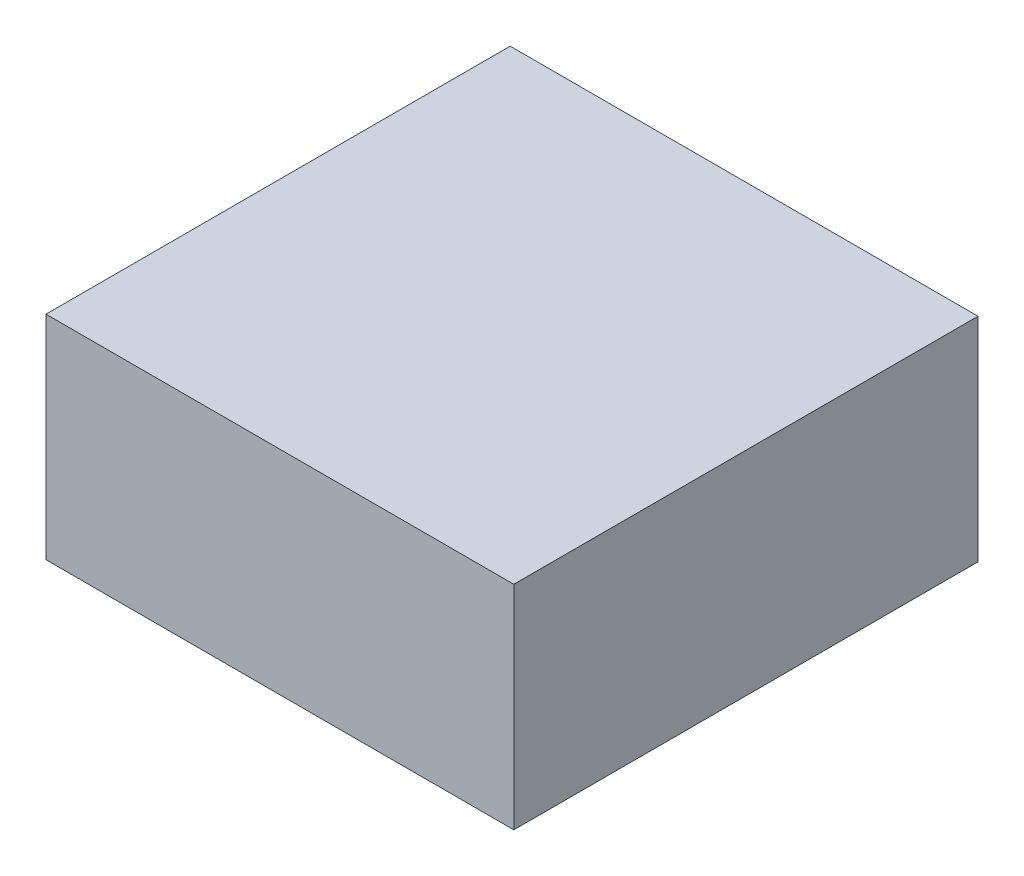
from build123d import *

# Parameters (mm, degrees)
SKETCH1_W                          = 11000
SKETCH1_H                          = 10900
PISO_DEPTH                         = 200
SKETCH2_W                          = 11000
SKETCH2_H                          = 10900
SKETCH2_W_2                        = 10600
SKETCH2_H_2                        = 10500
PAREDES_DEPTH                      = 3000
SKETCH7_W                          = 10600
SKETCH7_H                          = 10500
SKETCH7_W_2                        = 10480
SKETCH7_H_2                        = 10380
AISLANTE_PAREDES_DEPTH             = 3000
SKETCH27_W                         = 10480
SKETCH27_H                         = 10380
AISLANTE_SUELO_DEPTH               = 100
L_MINA_TRASERA_DEPTH               = 10
L_MINA_EXTERIOR_DEPTH              = 5450
BOSS_EXTRUDE24_DEPTH               = 100
BOSS_EXTRUDE34_DEPTH               = 10680
BOSS_EXTRUDE35_REACH               = 13070.542
BOSS_EXTRUDE36_REACH               = 12946.971
SKETCH45_W                         = 10480
SKETCH45_H                         = 2900
EXTERIOR_P1_DEPTH                  = 10900
SKETCH50_W                         = 13000
SKETCH50_H                         = 5910.466791247
EXTERIOR_P2_DEPTH                  = 1000
RACKS_GRILLOS_START                = 100
SKETCH21_W                         = 1828.8
SKETCH21_H                         = 914.4
RACKS_GRILLOS_DEPTH                = 2184.4
RACKS_GRILLOS_2_DEPTH              = 2184.4
RACKS_GRILLOS_3_DEPTH              = 2184.4
RACKS_GRILLOS_4_DEPTH              = 2184.4
RACKS_GRILLOS_5_DEPTH              = 2184.4
RACKS_GRILLOS_6_DEPTH              = 2184.4
RACKS_GRILLOS_7_DEPTH              = 2184.4
RACKS_GRILLOS_8_DEPTH              = 2184.4
RACKS_GRILLOS_9_DEPTH              = 2184.4
RACKS_GRILLOS_10_DEPTH             = 2184.4
RACKS_GRILLOS_11_DEPTH             = 2184.4
RACKS_GRILLOS_12_DEPTH             = 2184.4
RACKS_GRILLOS_13_DEPTH             = 2184.4
RACKS_GRILLOS_14_DEPTH             = 2184.4
RACKS_GRILLOS_15_DEPTH             = 2184.4
RACKS_GRILLOS_16_DEPTH             = 2184.4
RACKS_GRILLOS_17_DEPTH             = 2184.4
RACKS_GRILLOS_18_DEPTH             = 2184.4
RACKS_GRILLOS_19_DEPTH             = 2184.4
RACKS_GRILLOS_20_DEPTH             = 2184.4
RACKS_GRILLOS_21_DEPTH             = 2184.4
RACKS_GRILLOS_22_DEPTH             = 2184.4
RACKS_GRILLOS_23_DEPTH             = 2184.4
RACKS_GRILLOS_24_DEPTH             = 2184.4
BOSS_EXTRUDE37_DEPTH               = 400
DISTRIBUCI_N_CAJAS_RESISTENCIA_W   = 800
DISTRIBUCI_N_CAJAS_RESISTENCIA_H   = 300
BOSS_EXTRUDE37_2_DEPTH             = 400
BOSS_EXTRUDE37_3_DEPTH             = 400
BOSS_EXTRUDE37_4_DEPTH             = 400
BOSS_EXTRUDE37_5_DEPTH             = 400
BOSS_EXTRUDE37_6_DEPTH             = 400
DISTRIBUCI_N_CAJAS_RESISTENCIA_3_W = 600
DISTRIBUCI_N_CAJAS_RESISTENCIA_3_H = 100
BOSS_EXTRUDE38_DEPTH               = 400
BOSS_EXTRUDE38_2_DEPTH             = 400
SKETCH51_W                         = 914.4
SKETCH51_H                         = 2184.4
BOSS_EXTRUDE39_DEPTH               = 60
SKETCH52_W                         = 914.4
SKETCH52_H                         = 2184.4
BOSS_EXTRUDE40_DEPTH               = 60
SKETCH53_W                         = 1948.8
SKETCH53_H                         = 2184.4
BOSS_EXTRUDE41_DEPTH               = 60
SKETCH54_W                         = 1948.8
SKETCH54_H                         = 974.4
BOSS_EXTRUDE42_DEPTH               = 60
SKETCH55_W                         = 1948.8
SKETCH55_H                         = 2244.4
BOSS_EXTRUDE43_DEPTH               = 60


with BuildPart() as part:
    # Sketch1 → Piso (new body)
    with BuildSketch(Plane(origin=(0, 0, 0), x_dir=(1, 0, 0), z_dir=(0, 1, 0))):
        Rectangle(SKETCH1_W, SKETCH1_H)
    extrude(amount=PISO_DEPTH)


with BuildPart() as body_2:
    # Sketch2 → Paredes (new body)
    with BuildSketch(Plane(origin=(0, 200, 0), x_dir=(1, 0, 0), z_dir=(0, 1, 0))):
        Rectangle(SKETCH2_W, SKETCH2_H)
        Rectangle(SKETCH2_W_2, SKETCH2_H_2, mode=Mode.SUBTRACT)
    extrude(amount=PAREDES_DEPTH)


with BuildPart() as body_3:
    # Sketch7 → Aislante Paredes (new body)
    with BuildSketch(Plane(origin=(0, 200, 0), x_dir=(1, 0, 0), z_dir=(0, 1, 0))):
        Rectangle(SKETCH7_W, SKETCH7_H)
        Rectangle(SKETCH7_W_2, SKETCH7_H_2, mode=Mode.SUBTRACT)
    extrude(amount=AISLANTE_PAREDES_DEPTH)


with BuildPart() as body_4:
    # Sketch27 → Aislante suelo (new body)
    with BuildSketch(Plane(origin=(0, 200, 0), x_dir=(1, 0, 0), z_dir=(0, 1, 0))):
        Rectangle(SKETCH27_W, SKETCH27_H)
    extrude(amount=AISLANTE_SUELO_DEPTH)

    # Piso&aislante: union part
    add(part.part)


with BuildPart() as body_5:
    # Sketch20 → Lámina Trasera (new body)
    with BuildSketch(Plane(origin=(0, 0, -5450), x_dir=(1, 0, 0), z_dir=(0, 0, -1))):
        Polygon((0, -4900), (5500, -3200), (-5500, -3200), align=None)
    extrude(amount=-L_MINA_TRASERA_DEPTH)


with BuildPart() as body_6:
    # Lámina Frontal: mirrored copy
    add(body_5.part.mirror(Plane.XY))


with BuildPart() as body_7:
    # Sketch48 → Lámina Exterior (new, symmetric)
    with BuildSketch(Plane.XY):
        Polygon((-5500, 3200), (-5500, 3210.466791247), (0, 4910.466791247), (5500, 3210.466791247), (5500, 3200), (0, 4900), align=None)
    extrude(amount=L_MINA_EXTERIOR_DEPTH, both=True)


with BuildPart() as body_8:
    # Sketch35 → Boss-Extrude24 (new body)
    with BuildSketch(Plane.XY.offset(-5440)):
        Polygon((-5500, 3200), (0, 4900), (5500, 3200), align=None)
    extrude(amount=BOSS_EXTRUDE24_DEPTH)


with BuildPart() as body_9:
    # Mirror3: mirrored copy
    add(body_8.part.mirror(Plane.XY))


with BuildPart() as body_10:
    # Sketch43 → Boss-Extrude34 (new body)
    with BuildSketch(Plane(origin=(0, 0, 5340), x_dir=(-1, 0, 0), z_dir=(0, 0, -1))):
        Polygon((0, 4900), (0, 4795.33208753), (-5161.368518479, 3200), (-5500, 3200), align=None)
    extrude(amount=BOSS_EXTRUDE34_DEPTH)


with BuildPart() as body_11:
    # Mirror8: mirrored copy
    add(body_10.part.mirror(Plane(origin=(0, 0, 0), x_dir=(0, 0, 1), z_dir=(1, 0, 0))))

    # Combine_Aislante: union body 10, body 8, body 9
    add(body_10.part)
    add(body_8.part)
    add(body_9.part)


with BuildPart() as body_5_1:
    add(body_5.part)

    # Combine_Laminas: union body 6, body 7
    add(body_6.part)
    add(body_7.part)


with BuildPart() as body_7_2:

    # Sketch44 → Boss-Extrude35 (new, up to next)
    with BuildSketch(Plane(origin=(0, 0, 5340), x_dir=(-1, 0, 0), z_dir=(0, 0, -1)), mode=Mode.PRIVATE) as boss_extrude35_sk1:
        Polygon((-5161.368518479, 3200), (0, 4795.33208753), (5161.368518479, 3200), align=None)
    boss_extrude35_tool1 = extrude(boss_extrude35_sk1.sketch, amount=BOSS_EXTRUDE35_REACH, mode=Mode.PRIVATE) - body_11.part
    add(boss_extrude35_tool1.solids().sort_by_distance((0, 3731.777363, 5340))[0])


    # Sketch45 → Boss-Extrude36 (add, up to next)
    with BuildSketch(Plane(origin=(0, 0, 5190), x_dir=(-1, 0, 0), z_dir=(0, 0, -1)), mode=Mode.PRIVATE) as boss_extrude36_sk1:
        with Locations((0, 1750)):
            Rectangle(SKETCH45_W, SKETCH45_H)
    boss_extrude36_tool1 = extrude(boss_extrude36_sk1.sketch, amount=BOSS_EXTRUDE36_REACH, mode=Mode.PRIVATE) - body_3.part
    add(boss_extrude36_tool1.solids().sort_by_distance((0, 1750, 5190))[0])


with BuildPart() as body_6_2:
    # Sketch49 → Exterior_p1 (new body)
    with BuildSketch(Plane.XY.offset(5450)):
        Polygon((-5500, 0), (-6500, 0), (-6500, 5910.466791247), (6500, 5910.466791247), (6500, 0), (5500, 0), (5500, 3210.466791247), (0, 4910.466791247), (-5500, 3210.466791247), align=None)
    extrude(amount=-EXTERIOR_P1_DEPTH)


with BuildPart() as body_7_3:
    # Sketch50 → Exterior_p2 (new body)
    with BuildSketch(Plane.XY.offset(5450)):
        with Locations((0, 2955.233395624)):
            Rectangle(SKETCH50_W, SKETCH50_H)
    extrude(amount=EXTERIOR_P2_DEPTH)


with BuildPart() as body_8_2:
    # Mirror10: mirrored copy
    add(body_7_3.part.mirror(Plane.XY))


with BuildPart() as body_7_3_1:
    add(body_7_3.part)

    # Exterior: union body 6 2, body 8 2
    add(body_6_2.part)
    add(body_8_2.part)


with BuildPart() as body_7_4:
    # Sketch21 → Racks_grillos (new body)
    with BuildSketch(Plane(origin=(0, 200, 0), x_dir=(1, 0, 0), z_dir=(0, 1, 0)).offset(RACKS_GRILLOS_START)):
        with Locations((-3363.2, 2571.6)):
            Rectangle(SKETCH21_W, SKETCH21_H)
    extrude(amount=RACKS_GRILLOS_DEPTH)


with BuildPart() as body_8_3:
    # Sketch21 → Racks_grillos 2 (new body)
    with BuildSketch(Plane(origin=(0, 200, 0), x_dir=(1, 0, 0), z_dir=(0, 1, 0)).offset(RACKS_GRILLOS_START)):
        with Locations((-1514.4, 2571.6)):
            Rectangle(SKETCH21_W, SKETCH21_H)
    extrude(amount=RACKS_GRILLOS_2_DEPTH)


with BuildPart() as body_9_2:
    # Sketch21 → Racks_grillos 3 (new body)
    with BuildSketch(Plane(origin=(0, 200, 0), x_dir=(1, 0, 0), z_dir=(0, 1, 0)).offset(RACKS_GRILLOS_START)):
        with Locations((-3363.2, 1057.2)):
            Rectangle(SKETCH21_W, SKETCH21_H)
    extrude(amount=RACKS_GRILLOS_3_DEPTH)


with BuildPart() as body_10_2:
    # Sketch21 → Racks_grillos 4 (new body)
    with BuildSketch(Plane(origin=(0, 200, 0), x_dir=(1, 0, 0), z_dir=(0, 1, 0)).offset(RACKS_GRILLOS_START)):
        with Locations((-1514.4, 1057.2)):
            Rectangle(SKETCH21_W, SKETCH21_H)
    extrude(amount=RACKS_GRILLOS_4_DEPTH)


with BuildPart() as body_11_2:
    # Sketch21 → Racks_grillos 5 (new body)
    with BuildSketch(Plane(origin=(0, 200, 0), x_dir=(1, 0, 0), z_dir=(0, 1, 0)).offset(RACKS_GRILLOS_START)):
        with Locations((-3363.2, 4086)):
            Rectangle(SKETCH21_W, SKETCH21_H)
    extrude(amount=RACKS_GRILLOS_5_DEPTH)


with BuildPart() as body_12:
    # Sketch21 → Racks_grillos 6 (new body)
    with BuildSketch(Plane(origin=(0, 200, 0), x_dir=(1, 0, 0), z_dir=(0, 1, 0)).offset(RACKS_GRILLOS_START)):
        with Locations((-1514.4, 4086)):
            Rectangle(SKETCH21_W, SKETCH21_H)
    extrude(amount=RACKS_GRILLOS_6_DEPTH)


with BuildPart() as body_13:
    # Sketch21 → Racks_grillos 7 (new body)
    with BuildSketch(Plane(origin=(0, 200, 0), x_dir=(1, 0, 0), z_dir=(0, 1, 0)).offset(RACKS_GRILLOS_START)):
        with Locations((1514.4, 2571.6)):
            Rectangle(SKETCH21_W, SKETCH21_H)
    extrude(amount=RACKS_GRILLOS_7_DEPTH)


with BuildPart() as body_14:
    # Sketch21 → Racks_grillos 8 (new body)
    with BuildSketch(Plane(origin=(0, 200, 0), x_dir=(1, 0, 0), z_dir=(0, 1, 0)).offset(RACKS_GRILLOS_START)):
        with Locations((1514.4, 1057.2)):
            Rectangle(SKETCH21_W, SKETCH21_H)
    extrude(amount=RACKS_GRILLOS_8_DEPTH)


with BuildPart() as body_15:
    # Sketch21 → Racks_grillos 9 (new body)
    with BuildSketch(Plane(origin=(0, 200, 0), x_dir=(1, 0, 0), z_dir=(0, 1, 0)).offset(RACKS_GRILLOS_START)):
        with Locations((1514.4, 4086)):
            Rectangle(SKETCH21_W, SKETCH21_H)
    extrude(amount=RACKS_GRILLOS_9_DEPTH)


with BuildPart() as body_16:
    # Sketch21 → Racks_grillos 10 (new body)
    with BuildSketch(Plane(origin=(0, 200, 0), x_dir=(1, 0, 0), z_dir=(0, 1, 0)).offset(RACKS_GRILLOS_START)):
        with Locations((3363.2, 4086)):
            Rectangle(SKETCH21_W, SKETCH21_H)
    extrude(amount=RACKS_GRILLOS_10_DEPTH)


with BuildPart() as body_17:
    # Sketch21 → Racks_grillos 11 (new body)
    with BuildSketch(Plane(origin=(0, 200, 0), x_dir=(1, 0, 0), z_dir=(0, 1, 0)).offset(RACKS_GRILLOS_START)):
        with Locations((3363.2, 1057.2)):
            Rectangle(SKETCH21_W, SKETCH21_H)
    extrude(amount=RACKS_GRILLOS_11_DEPTH)


with BuildPart() as body_18:
    # Sketch21 → Racks_grillos 12 (new body)
    with BuildSketch(Plane(origin=(0, 200, 0), x_dir=(1, 0, 0), z_dir=(0, 1, 0)).offset(RACKS_GRILLOS_START)):
        with Locations((3363.2, 2571.6)):
            Rectangle(SKETCH21_W, SKETCH21_H)
    extrude(amount=RACKS_GRILLOS_12_DEPTH)


with BuildPart() as body_19:
    # Sketch21 → Racks_grillos 13 (new body)
    with BuildSketch(Plane(origin=(0, 200, 0), x_dir=(1, 0, 0), z_dir=(0, 1, 0)).offset(RACKS_GRILLOS_START)):
        with Locations((3363.2, -2571.6)):
            Rectangle(SKETCH21_W, SKETCH21_H)
    extrude(amount=RACKS_GRILLOS_13_DEPTH)


with BuildPart() as body_20:
    # Sketch21 → Racks_grillos 14 (new body)
    with BuildSketch(Plane(origin=(0, 200, 0), x_dir=(1, 0, 0), z_dir=(0, 1, 0)).offset(RACKS_GRILLOS_START)):
        with Locations((1514.4, -2571.6)):
            Rectangle(SKETCH21_W, SKETCH21_H)
    extrude(amount=RACKS_GRILLOS_14_DEPTH)


with BuildPart() as body_21:
    # Sketch21 → Racks_grillos 15 (new body)
    with BuildSketch(Plane(origin=(0, 200, 0), x_dir=(1, 0, 0), z_dir=(0, 1, 0)).offset(RACKS_GRILLOS_START)):
        with Locations((3363.2, -1057.2)):
            Rectangle(SKETCH21_W, SKETCH21_H)
    extrude(amount=RACKS_GRILLOS_15_DEPTH)


with BuildPart() as body_22:
    # Sketch21 → Racks_grillos 16 (new body)
    with BuildSketch(Plane(origin=(0, 200, 0), x_dir=(1, 0, 0), z_dir=(0, 1, 0)).offset(RACKS_GRILLOS_START)):
        with Locations((1514.4, -1057.2)):
            Rectangle(SKETCH21_W, SKETCH21_H)
    extrude(amount=RACKS_GRILLOS_16_DEPTH)


with BuildPart() as body_23:
    # Sketch21 → Racks_grillos 17 (new body)
    with BuildSketch(Plane(origin=(0, 200, 0), x_dir=(1, 0, 0), z_dir=(0, 1, 0)).offset(RACKS_GRILLOS_START)):
        with Locations((3363.2, -4086)):
            Rectangle(SKETCH21_W, SKETCH21_H)
    extrude(amount=RACKS_GRILLOS_17_DEPTH)


with BuildPart() as body_24:
    # Sketch21 → Racks_grillos 18 (new body)
    with BuildSketch(Plane(origin=(0, 200, 0), x_dir=(1, 0, 0), z_dir=(0, 1, 0)).offset(RACKS_GRILLOS_START)):
        with Locations((1514.4, -4086)):
            Rectangle(SKETCH21_W, SKETCH21_H)
    extrude(amount=RACKS_GRILLOS_18_DEPTH)


with BuildPart() as body_25:
    # Sketch21 → Racks_grillos 19 (new body)
    with BuildSketch(Plane(origin=(0, 200, 0), x_dir=(1, 0, 0), z_dir=(0, 1, 0)).offset(RACKS_GRILLOS_START)):
        with Locations((-1514.4, -2571.6)):
            Rectangle(SKETCH21_W, SKETCH21_H)
    extrude(amount=RACKS_GRILLOS_19_DEPTH)


with BuildPart() as body_26:
    # Sketch21 → Racks_grillos 20 (new body)
    with BuildSketch(Plane(origin=(0, 200, 0), x_dir=(1, 0, 0), z_dir=(0, 1, 0)).offset(RACKS_GRILLOS_START)):
        with Locations((-1514.4, -1057.2)):
            Rectangle(SKETCH21_W, SKETCH21_H)
    extrude(amount=RACKS_GRILLOS_20_DEPTH)


with BuildPart() as body_27:
    # Sketch21 → Racks_grillos 21 (new body)
    with BuildSketch(Plane(origin=(0, 200, 0), x_dir=(1, 0, 0), z_dir=(0, 1, 0)).offset(RACKS_GRILLOS_START)):
        with Locations((-1514.4, -4086)):
            Rectangle(SKETCH21_W, SKETCH21_H)
    extrude(amount=RACKS_GRILLOS_21_DEPTH)


with BuildPart() as body_28:
    # Sketch21 → Racks_grillos 22 (new body)
    with BuildSketch(Plane(origin=(0, 200, 0), x_dir=(1, 0, 0), z_dir=(0, 1, 0)).offset(RACKS_GRILLOS_START)):
        with Locations((-3363.2, -4086)):
            Rectangle(SKETCH21_W, SKETCH21_H)
    extrude(amount=RACKS_GRILLOS_22_DEPTH)


with BuildPart() as body_29:
    # Sketch21 → Racks_grillos 23 (new body)
    with BuildSketch(Plane(origin=(0, 200, 0), x_dir=(1, 0, 0), z_dir=(0, 1, 0)).offset(RACKS_GRILLOS_START)):
        with Locations((-3363.2, -1057.2)):
            Rectangle(SKETCH21_W, SKETCH21_H)
    extrude(amount=RACKS_GRILLOS_23_DEPTH)


with BuildPart() as body_30:
    # Sketch21 → Racks_grillos 24 (new body)
    with BuildSketch(Plane(origin=(0, 200, 0), x_dir=(1, 0, 0), z_dir=(0, 1, 0)).offset(RACKS_GRILLOS_START)):
        with Locations((-3363.2, -2571.6)):
            Rectangle(SKETCH21_W, SKETCH21_H)
    extrude(amount=RACKS_GRILLOS_24_DEPTH)


with BuildPart() as body_31:
    # Distribuci_n cajas resistencia → Boss-Extrude37 (new body)
    with BuildSketch(Plane.XY.offset(4543.2)):
        Polygon((-4213.2, 2238.3), (-4213.2, 1938.3), (-3859.846307309, 1938.3), (-3713.2, 1938.3), (-3413.2, 1938.3), (-3413.2, 2238.3), align=None)
    extrude(amount=-BOSS_EXTRUDE37_DEPTH)


with BuildPart() as body_32:
    # Distribuci_n cajas resistencia → Boss-Extrude37 2 (new body)
    with BuildSketch(Plane.XY.offset(4543.2)):
        with Locations((-2913.2, 2088.3)):
            Rectangle(DISTRIBUCI_N_CAJAS_RESISTENCIA_W, DISTRIBUCI_N_CAJAS_RESISTENCIA_H)
    extrude(amount=-BOSS_EXTRUDE37_2_DEPTH)


with BuildPart() as body_33:
    # Distribuci_n cajas resistencia → Boss-Extrude37 3 (new body)
    with BuildSketch(Plane.XY.offset(4543.2)):
        with Locations((-2913.2, 1542.2)):
            Rectangle(DISTRIBUCI_N_CAJAS_RESISTENCIA_W, DISTRIBUCI_N_CAJAS_RESISTENCIA_H)
    extrude(amount=-BOSS_EXTRUDE37_3_DEPTH)


with BuildPart() as body_34:
    # Distribuci_n cajas resistencia → Boss-Extrude37 4 (new body)
    with BuildSketch(Plane.XY.offset(4543.2)):
        with Locations((-3813.2, 996.1)):
            Rectangle(DISTRIBUCI_N_CAJAS_RESISTENCIA_W, DISTRIBUCI_N_CAJAS_RESISTENCIA_H)
    extrude(amount=-BOSS_EXTRUDE37_4_DEPTH)


with BuildPart() as body_35:
    # Distribuci_n cajas resistencia → Boss-Extrude37 5 (new body)
    with BuildSketch(Plane.XY.offset(4543.2)):
        with Locations((-3813.2, 1542.2)):
            Rectangle(DISTRIBUCI_N_CAJAS_RESISTENCIA_W, DISTRIBUCI_N_CAJAS_RESISTENCIA_H)
    extrude(amount=-BOSS_EXTRUDE37_5_DEPTH)


with BuildPart() as body_36:
    # Distribuci_n cajas resistencia → Boss-Extrude37 6 (new body)
    with BuildSketch(Plane.XY.offset(4543.2)):
        with Locations((-2913.2, 996.1)):
            Rectangle(DISTRIBUCI_N_CAJAS_RESISTENCIA_W, DISTRIBUCI_N_CAJAS_RESISTENCIA_H)
    extrude(amount=-BOSS_EXTRUDE37_6_DEPTH)


with BuildPart() as body_37:
    # Distribución cajas resistencia <3> → Boss-Extrude38 (new body)
    with BuildSketch(Plane.XY.offset(4543.2)):
        with Locations((-2913.2, 350)):
            Rectangle(DISTRIBUCI_N_CAJAS_RESISTENCIA_3_W, DISTRIBUCI_N_CAJAS_RESISTENCIA_3_H)
    extrude(amount=-BOSS_EXTRUDE38_DEPTH)


with BuildPart() as body_38:
    # Distribución cajas resistencia <3> → Boss-Extrude38 2 (new body)
    with BuildSketch(Plane.XY.offset(4543.2)):
        with Locations((-3813.2, 350)):
            Rectangle(DISTRIBUCI_N_CAJAS_RESISTENCIA_3_W, DISTRIBUCI_N_CAJAS_RESISTENCIA_3_H)
    extrude(amount=-BOSS_EXTRUDE38_2_DEPTH)


with BuildPart() as body_39:
    # Mirror11: mirrored copy
    add(body_31.part.mirror(Plane.XY.offset(4086)))


with BuildPart() as body_40:
    # Mirror11 2: mirrored copy
    add(body_32.part.mirror(Plane.XY.offset(4086)))


with BuildPart() as body_41:
    # Mirror11 3: mirrored copy
    add(body_33.part.mirror(Plane.XY.offset(4086)))


with BuildPart() as body_42:
    # Mirror11 4: mirrored copy
    add(body_34.part.mirror(Plane.XY.offset(4086)))


with BuildPart() as body_43:
    # Mirror11 5: mirrored copy
    add(body_35.part.mirror(Plane.XY.offset(4086)))


with BuildPart() as body_44:
    # Mirror11 6: mirrored copy
    add(body_36.part.mirror(Plane.XY.offset(4086)))


with BuildPart() as body_45:
    # Mirror11 7: mirrored copy
    add(body_37.part.mirror(Plane.XY.offset(4086)))


with BuildPart() as body_46:
    # Mirror11 8: mirrored copy
    add(body_38.part.mirror(Plane.XY.offset(4086)))


with BuildPart() as body_47:
    # Sketch51 → Boss-Extrude39 (new body)
    with BuildSketch(Plane.ZY.offset(4277.6)):
        with Locations((4086, 1392.2)):
            Rectangle(SKETCH51_W, SKETCH51_H)
    extrude(amount=BOSS_EXTRUDE39_DEPTH)


with BuildPart() as body_48:
    # Sketch52 → Boss-Extrude40 (new body)
    with BuildSketch(Plane(origin=(-2448.8, 0, 0), x_dir=(0, 0, -1), z_dir=(1, 0, 0))):
        with Locations((-4086, 1392.2)):
            Rectangle(SKETCH52_W, SKETCH52_H)
    extrude(amount=BOSS_EXTRUDE40_DEPTH)


with BuildPart() as body_49:
    # Sketch53 → Boss-Extrude41 (new body)
    with BuildSketch(Plane(origin=(0, 0, 3628.8), x_dir=(-1, 0, 0), z_dir=(0, 0, -1))):
        with Locations((3363.2, 1392.2)):
            Rectangle(SKETCH53_W, SKETCH53_H)
    extrude(amount=BOSS_EXTRUDE41_DEPTH)


with BuildPart() as body_50:
    # Sketch54 → Boss-Extrude42 (new body)
    with BuildSketch(Plane(origin=(0, 2484.4, 0), x_dir=(1, 0, 0), z_dir=(0, 1, 0))):
        with Locations((-3363.2, -4056)):
            Rectangle(SKETCH54_W, SKETCH54_H)
    extrude(amount=BOSS_EXTRUDE42_DEPTH)


with BuildPart() as body_51:
    # Sketch55 → Boss-Extrude43 (new body)
    with BuildSketch(Plane.XY.offset(4543.2)):
        with Locations((-3363.2, 1422.2)):
            Rectangle(SKETCH55_W, SKETCH55_H)
    extrude(amount=BOSS_EXTRUDE43_DEPTH)

    # Combine1: union body 50, body 48, body 49, body 47
    add(body_50.part)
    add(body_48.part)
    add(body_49.part)
    add(body_47.part)


solid = Compound([body_2.part, body_3.part, body_4.part, body_11.part, body_5_1.part, body_7_3_1.part, body_7_4.part, body_8_3.part, body_9_2.part, body_10_2.part, body_11_2.part, body_12.part, body_13.part, body_14.part, body_15.part, body_16.part, body_17.part, body_18.part, body_19.part, body_20.part, body_21.part, body_22.part, body_23.part, body_24.part, body_25.part, body_26.part, body_27.part, body_28.part, body_29.part, body_30.part, body_31.part, body_32.part, body_33.part, body_34.part, body_35.part, body_36.part, body_37.part, body_38.part, body_39.part, body_40.part, body_41.part, body_42.part, body_43.part, body_44.part, body_45.part, body_46.part, body_51.part])
